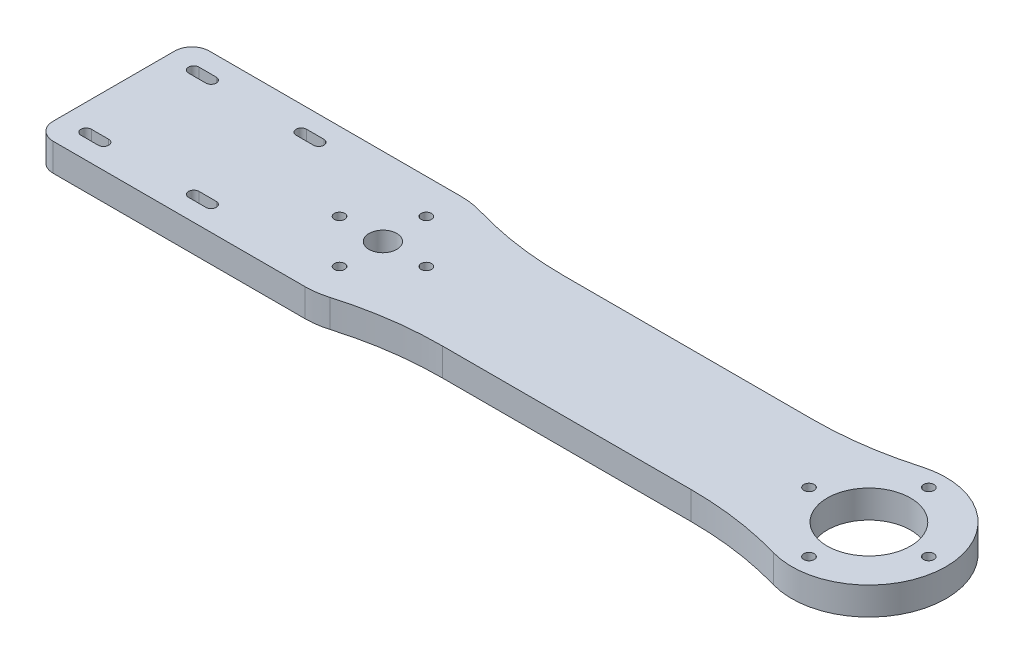
from build123d import *

# Parameters (mm, degrees)
SKETCH1_R           = 4
BOSS_EXTRUDE1_DEPTH = 8
BOSS_EXTRUDE2_START = -8
SKETCH2_R           = 4
BOSS_EXTRUDE2_DEPTH = 8
FILLET1_R           = 5
SKETCH3_R           = 1.5
CUT_EXTRUDE1_DEPTH  = 19
SKETCH4_R           = 1.5
SKETCH4_R_2         = 12
CUT_EXTRUDE2_DEPTH  = 19
FILLET2_R           = 100


with BuildPart() as part:
    # Sketch1 → Boss-Extrude1 (new body)
    with BuildSketch(Plane(origin=(0, 0, 0), x_dir=(1, 0, 0), z_dir=(0, 1, 0))):
        with BuildLine():
            Line((0, -17.5), (126.259093916, -17.5))
            ThreePointArc((126.259093916, -17.5), (162.25, 0), (126.259093916, 17.5))
            Line((126.259093916, 17.5), (0, 17.5))
            ThreePointArc((0, 17.5), (-17.5, 0), (0, -17.5))
        make_face()
        with Locations(Location((140, 0, 0), (0, 0, 270))):
            Circle(SKETCH1_R, mode=Mode.SUBTRACT)
        with Locations(Location((0, 0, 0), (0, 0, 270))):
            Circle(SKETCH1_R, mode=Mode.SUBTRACT)
    extrude(amount=BOSS_EXTRUDE1_DEPTH)

    # Sketch2 → Boss-Extrude2 (add)
    with BuildSketch(Plane(origin=(0, 8, 0), x_dir=(1, 0, 0), z_dir=(0, 1, 0)).offset(BOSS_EXTRUDE2_START)):
        with BuildLine():
            Line((0, 22.5), (-77.5, 22.5))
            Line((-77.5, 22.5), (-77.5, -22.5))
            Line((-77.5, -22.5), (0, -22.5))
            ThreePointArc((0, -22.5), (22.5, 0), (0, 22.5))
        make_face()
        with BuildLine():
            ThreePointArc((-65, -14), (-63.5, -15.5), (-65, -17))
            Line((-65, -17), (-70, -17))
            ThreePointArc((-70, -17), (-71.5, -15.5), (-70, -14))
            Line((-70, -14), (-65, -14))
        make_face(mode=Mode.SUBTRACT)
        with BuildLine():
            Line((-39, -14), (-38, -14))
            Line((-38, -14), (-34, -14))
            ThreePointArc((-34, -14), (-32.5, -15.5), (-34, -17))
            Line((-34, -17), (-39, -17))
            ThreePointArc((-39, -17), (-40.5, -15.5), (-39, -14))
        make_face(mode=Mode.SUBTRACT)
        with BuildLine():
            ThreePointArc((-65, 17), (-63.5, 15.5), (-65, 14))
            Line((-65, 14), (-70, 14))
            ThreePointArc((-70, 14), (-71.5, 15.5), (-70, 17))
            Line((-70, 17), (-65, 17))
        make_face(mode=Mode.SUBTRACT)
        with BuildLine():
            ThreePointArc((-34, 17), (-32.5, 15.5), (-34, 14))
            Line((-34, 14), (-39, 14))
            ThreePointArc((-39, 14), (-40.5, 15.5), (-39, 17))
            Line((-39, 17), (-34, 17))
        make_face(mode=Mode.SUBTRACT)
        with Locations(Location((0, 0, 0), (0, 0, 270))):
            Circle(SKETCH2_R, mode=Mode.SUBTRACT)
    extrude(amount=BOSS_EXTRUDE2_DEPTH)

    # Fillet1
    fillet1_edges = [part.edges().sort_by_distance(p)[0] for p in [
        (-77.5, 4, -22.5),
        (-77.5, 4, 22.5),
    ]]
    fillet(fillet1_edges, radius=FILLET1_R)

    # Sketch3 → Cut-Extrude1 (cut)
    with BuildSketch(Plane(origin=(0, 8, 0), x_dir=(1, 0, 0), z_dir=(0, 1, 0))):
        with Locations(Location((0, 12.5, 0), (0, 0, 270))):
            Circle(SKETCH3_R)
        with Locations(Location((12.5, 0, 0), (0, 0, 270))):
            Circle(SKETCH3_R)
        with Locations(Location((0, -12.5, 0), (0, 0, 270))):
            Circle(SKETCH3_R)
        with Locations(Location((-12.5, 0, 0), (0, 0, 270))):
            Circle(SKETCH3_R)
    extrude(amount=-CUT_EXTRUDE1_DEPTH, mode=Mode.SUBTRACT)

    # Sketch4 → Cut-Extrude2 (cut)
    with BuildSketch(Plane(origin=(0, 8, 0), x_dir=(1, 0, 0), z_dir=(0, 1, 0))):
        with Locations(Location((157.25, 0, 0), (0, 0, 270))):
            Circle(SKETCH4_R)
        with Locations(Location((140, -17.25, 0), (0, 0, 270))):
            Circle(SKETCH4_R)
        with Locations(Location((122.75, 0, 0), (0, 0, 270))):
            Circle(SKETCH4_R)
        with Locations(Location((140, 17.25, 0), (0, 0, 270))):
            Circle(SKETCH4_R)
        with Locations(Location((140, 0, 0), (0, 0, 270))):
            Circle(SKETCH4_R_2)
    extrude(amount=-CUT_EXTRUDE2_DEPTH, mode=Mode.SUBTRACT)

    # Fillet2
    fillet2_edges = [part.edges().sort_by_distance(p)[0] for p in [
        (126.259093916, 4, -17.5),
        (126.259093916, 4, 17.5),
        (14.142135624, 4, -17.5),
        (14.142135624, 4, 17.5),
    ]]
    fillet(fillet2_edges, radius=FILLET2_R)


solid = part.part
